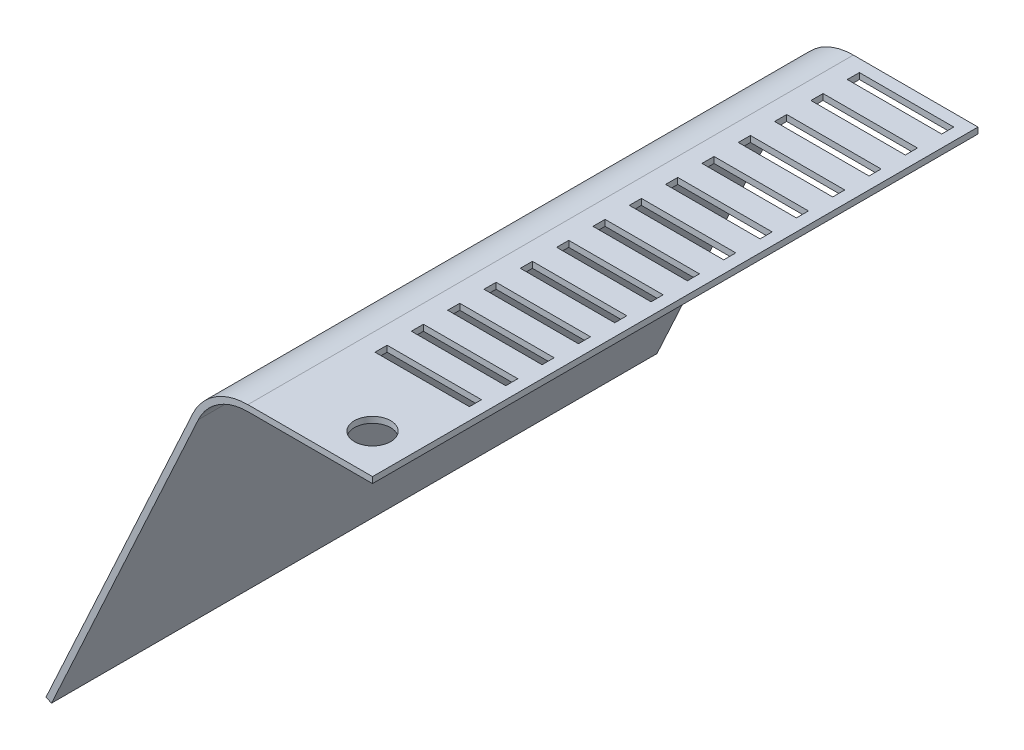
from build123d import *

# Parameters (mm, degrees)
EXTRUDE_THIN1_DEPTH = 500
SKETCH3_W           = 155.92
SKETCH3_H           = 20
CUT_EXTRUDE1_DEPTH  = 226
LPATTERN1_COUNT     = 14
LPATTERN1_PITCH     = 60
SKETCH4_R           = 30
CUT_EXTRUDE2_DEPTH  = 226


with BuildPart() as part:
    # Sketch1 → Extrude-Thin1 (new, symmetric)
    with BuildSketch(Plane.XY):
        with BuildLine():
            Line((0, 0), (-205.92, 0))
            ThreePointArc((-205.92, 0), (-259.855879639, -15.792394123), (-296.756225905, -58.181582248))
            Line((-296.756225905, -58.181582248), (-539.303048865, -585.0316925))
            Line((-539.303048865, -585.0316925), (-530.219426274, -589.213534275))
            Line((-530.219426274, -589.213534275), (-287.672603315, -62.363424024))
            ThreePointArc((-287.672603315, -62.363424024), (-254.462291675, -24.21315471), (-205.92, -10))
            Line((-205.92, -10), (0, -10))
            Line((0, -10), (0, 0))
        make_face()
    extrude(amount=EXTRUDE_THIN1_DEPTH, both=True)

    # Sketch3 → Cut-Extrude1 (cut, symmetric)
    with BuildSketch(Plane(origin=(0, 0, 0), x_dir=(1, 0, 0), z_dir=(0, 1, 0))):
        with Locations((-97.96, 470)):
            Rectangle(SKETCH3_W, SKETCH3_H)
    cut_extrude1 = extrude(amount=CUT_EXTRUDE1_DEPTH, both=True, mode=Mode.SUBTRACT)

    # LPattern1: Cut-Extrude1 ×14
    with Locations(*[(0, 0, i * LPATTERN1_PITCH) for i in range(1, LPATTERN1_COUNT)]):
        add(cut_extrude1, mode=Mode.SUBTRACT)

    # Sketch4 → Cut-Extrude2 (cut, symmetric)
    with BuildSketch(Plane(origin=(0, 0, 0), x_dir=(1, 0, 0), z_dir=(0, 1, 0))):
        with Locations(Location((-65, -435, 0), (0, 0, 180))):
            Circle(SKETCH4_R)
    extrude(amount=CUT_EXTRUDE2_DEPTH, both=True, mode=Mode.SUBTRACT)


solid = part.part
